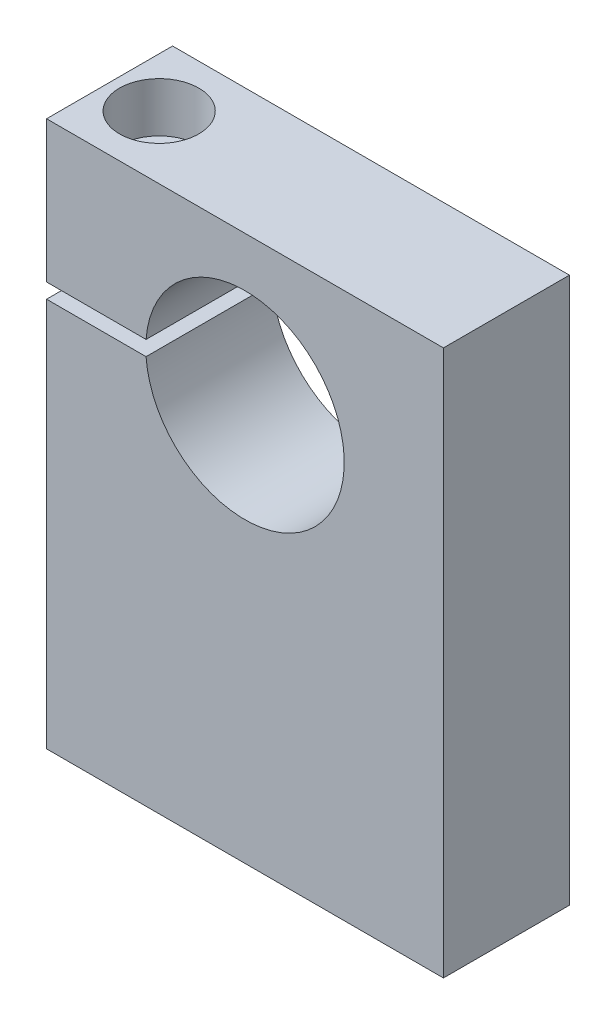
from build123d import *

# Parameters (mm, degrees)
SALIENTE_EXTRUIR1_DEPTH = 12.7
CROQUIS2_R              = 2
CORTAR_EXTRUIR1_DEPTH   = 23
CROQUIS3_R              = 4
CORTAR_EXTRUIR2_DEPTH   = 5
CROQUIS4_R              = 3.96875
CORTAR_EXTRUIR3_DEPTH   = 15


with BuildPart() as part:
    # Croquis1 → Saliente-Extruir1 (new body)
    with BuildSketch(Plane.XY):
        with BuildLine():
            ThreePointArc((-9.971835338, -0.75), (10, 0), (-9.971835338, 0.75))
            Line((-9.971835338, 0.75), (-20, 0.75))
            Line((-20, 0.75), (-20, 15))
            Line((-20, 15), (20, 15))
            Line((20, 15), (20, -40))
            Line((20, -40), (-20, -40))
            Line((-20, -40), (-20, -0.75))
            Line((-20, -0.75), (-9.971835338, -0.75))
        make_face()
    extrude(amount=SALIENTE_EXTRUIR1_DEPTH)

    # Croquis2 → Cortar-Extruir1 (cut)
    with BuildSketch(Plane(origin=(0, 15, 0), x_dir=(1, 0, 0), z_dir=(0, 1, 0))):
        with Locations(Location((-15.000994664, -6.35, 0), (0, 0, 180))):
            Circle(CROQUIS2_R)
    extrude(amount=-CORTAR_EXTRUIR1_DEPTH, mode=Mode.SUBTRACT)

    # Croquis3 → Cortar-Extruir2 (cut)
    with BuildSketch(Plane(origin=(0, 15, 0), x_dir=(1, 0, 0), z_dir=(0, 1, 0))):
        with Locations(Location((-15.000994664, -6.35, 0), (0, 0, 180))):
            Circle(CROQUIS3_R)
    extrude(amount=-CORTAR_EXTRUIR2_DEPTH, mode=Mode.SUBTRACT)

    # Croquis4 → Cortar-Extruir3 (cut)
    with BuildSketch(Plane.XZ.offset(40)):
        with Locations(Location((-12.5, 6.35, 0), (0, 0, 270))):
            Circle(CROQUIS4_R)
        with Locations(Location((12.5, 6.35, 0), (0, 0, 270))):
            Circle(CROQUIS4_R)
    extrude(amount=-CORTAR_EXTRUIR3_DEPTH, mode=Mode.SUBTRACT)


solid = part.part
